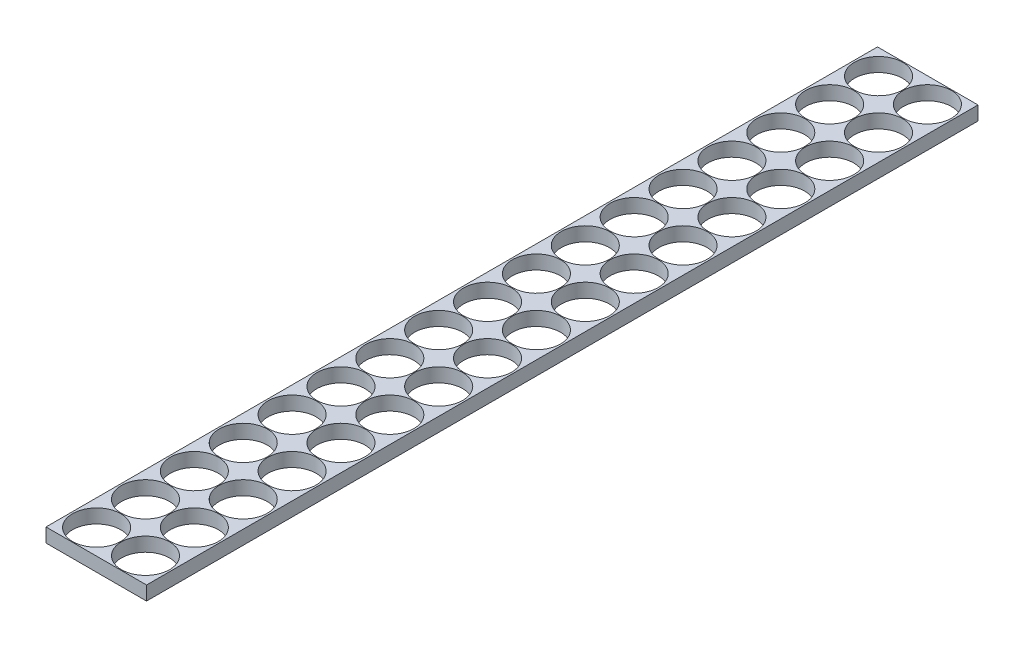
from build123d import *

# Parameters (mm, degrees)
BOSS_EXTRUDE1_DEPTH = 1


with BuildPart() as part:
    # Sketch1 → Boss-Extrude1 (new body)
    with BuildSketch(Plane(origin=(0, 0, 0), x_dir=(1, 0, 0), z_dir=(0, 1, 0))):
        with BuildLine():
            Line((1.85, -59.55), (3.6, -59.55))
            Line((3.6, -59.55), (3.6, 0))
            Line((3.6, 0), (1.85, 0))
            Line((1.85, 0), (1.85, -0.05))
            ThreePointArc((1.85, -0.05), (3.069759198, -0.555240802), (3.575, -1.775))
            ThreePointArc((3.575, -1.775), (3.069759198, -2.994759198), (1.85, -3.5))
            Line((1.85, -3.5), (1.85, -3.55))
            ThreePointArc((1.85, -3.55), (3.069759198, -4.055240802), (3.575, -5.275))
            ThreePointArc((3.575, -5.275), (3.069759198, -6.494759198), (1.85, -7))
            Line((1.85, -7), (1.85, -7.05))
            ThreePointArc((1.85, -7.05), (3.069759198, -7.555240802), (3.575, -8.775))
            ThreePointArc((3.575, -8.775), (3.069759198, -9.994759198), (1.85, -10.5))
            Line((1.85, -10.5), (1.85, -10.55))
            ThreePointArc((1.85, -10.55), (3.069759198, -11.055240802), (3.575, -12.275))
            ThreePointArc((3.575, -12.275), (3.069759198, -13.494759198), (1.85, -14))
            Line((1.85, -14), (1.85, -14.05))
            ThreePointArc((1.85, -14.05), (3.069759198, -14.555240802), (3.575, -15.775))
            ThreePointArc((3.575, -15.775), (3.069759198, -16.994759198), (1.85, -17.5))
            Line((1.85, -17.5), (1.85, -17.55))
            ThreePointArc((1.85, -17.55), (3.069759198, -18.055240802), (3.575, -19.275))
            ThreePointArc((3.575, -19.275), (3.069759198, -20.494759198), (1.85, -21))
            Line((1.85, -21), (1.85, -21.05))
            ThreePointArc((1.85, -21.05), (3.069759198, -21.555240802), (3.575, -22.775))
            ThreePointArc((3.575, -22.775), (3.069759198, -23.994759198), (1.85, -24.5))
            Line((1.85, -24.5), (1.85, -24.55))
            ThreePointArc((1.85, -24.55), (3.069759198, -25.055240802), (3.575, -26.275))
            ThreePointArc((3.575, -26.275), (3.069759198, -27.494759198), (1.85, -28))
            Line((1.85, -28), (1.85, -28.05))
            ThreePointArc((1.85, -28.05), (3.069759198, -28.555240802), (3.575, -29.775))
            ThreePointArc((3.575, -29.775), (3.069759198, -30.994759198), (1.85, -31.5))
            Line((1.85, -31.5), (1.85, -31.55))
            ThreePointArc((1.85, -31.55), (3.069759198, -32.055240802), (3.575, -33.275))
            ThreePointArc((3.575, -33.275), (3.069759198, -34.494759198), (1.85, -35))
            Line((1.85, -35), (1.85, -35.05))
            ThreePointArc((1.85, -35.05), (3.069759198, -35.555240802), (3.575, -36.775))
            ThreePointArc((3.575, -36.775), (3.069759198, -37.994759198), (1.85, -38.5))
            Line((1.85, -38.5), (1.85, -38.55))
            ThreePointArc((1.85, -38.55), (3.069759198, -39.055240802), (3.575, -40.275))
            ThreePointArc((3.575, -40.275), (3.069759198, -41.494759198), (1.85, -42))
            Line((1.85, -42), (1.85, -42.05))
            ThreePointArc((1.85, -42.05), (3.069759198, -42.555240802), (3.575, -43.775))
            ThreePointArc((3.575, -43.775), (3.069759198, -44.994759198), (1.85, -45.5))
            Line((1.85, -45.5), (1.85, -45.55))
            ThreePointArc((1.85, -45.55), (3.069759198, -46.055240802), (3.575, -47.275))
            ThreePointArc((3.575, -47.275), (3.069759198, -48.494759198), (1.85, -49))
            Line((1.85, -49), (1.85, -49.05))
            ThreePointArc((1.85, -49.05), (3.069759198, -49.555240802), (3.575, -50.775))
            ThreePointArc((3.575, -50.775), (3.069759198, -51.994759198), (1.85, -52.5))
            Line((1.85, -52.5), (1.85, -52.55))
            ThreePointArc((1.85, -52.55), (3.069759198, -53.055240802), (3.575, -54.275))
            ThreePointArc((3.575, -54.275), (3.069759198, -55.494759198), (1.85, -56))
            Line((1.85, -56), (1.85, -56.05))
            ThreePointArc((1.85, -56.05), (3.069759198, -56.555240802), (3.575, -57.775))
            ThreePointArc((3.575, -57.775), (3.069759198, -58.994759198), (1.85, -59.5))
            Line((1.85, -59.5), (1.85, -59.55))
        make_face()
        with BuildLine():
            Line((0, -59.55), (1.85, -59.55))
            Line((1.85, -59.55), (1.85, -59.5))
            ThreePointArc((1.85, -59.5), (0.125, -57.775), (1.85, -56.05))
            Line((1.85, -56.05), (1.85, -56))
            ThreePointArc((1.85, -56), (0.125, -54.275), (1.85, -52.55))
            Line((1.85, -52.55), (1.85, -52.5))
            ThreePointArc((1.85, -52.5), (0.125, -50.775), (1.85, -49.05))
            Line((1.85, -49.05), (1.85, -49))
            ThreePointArc((1.85, -49), (0.125, -47.275), (1.85, -45.55))
            Line((1.85, -45.55), (1.85, -45.5))
            ThreePointArc((1.85, -45.5), (0.125, -43.775), (1.85, -42.05))
            Line((1.85, -42.05), (1.85, -42))
            ThreePointArc((1.85, -42), (0.125, -40.275), (1.85, -38.55))
            Line((1.85, -38.55), (1.85, -38.5))
            ThreePointArc((1.85, -38.5), (0.125, -36.775), (1.85, -35.05))
            Line((1.85, -35.05), (1.85, -35))
            ThreePointArc((1.85, -35), (0.125, -33.275), (1.85, -31.55))
            Line((1.85, -31.55), (1.85, -31.5))
            ThreePointArc((1.85, -31.5), (0.125, -29.775), (1.85, -28.05))
            Line((1.85, -28.05), (1.85, -28))
            ThreePointArc((1.85, -28), (0.125, -26.275), (1.85, -24.55))
            Line((1.85, -24.55), (1.85, -24.5))
            ThreePointArc((1.85, -24.5), (0.125, -22.775), (1.85, -21.05))
            Line((1.85, -21.05), (1.85, -21))
            ThreePointArc((1.85, -21), (0.125, -19.275), (1.85, -17.55))
            Line((1.85, -17.55), (1.85, -17.5))
            ThreePointArc((1.85, -17.5), (0.125, -15.775), (1.85, -14.05))
            Line((1.85, -14.05), (1.85, -14))
            ThreePointArc((1.85, -14), (0.125, -12.275), (1.85, -10.55))
            Line((1.85, -10.55), (1.85, -10.5))
            ThreePointArc((1.85, -10.5), (0.125, -8.775), (1.85, -7.05))
            Line((1.85, -7.05), (1.85, -7))
            ThreePointArc((1.85, -7), (0.125, -5.275), (1.85, -3.55))
            Line((1.85, -3.55), (1.85, -3.5))
            ThreePointArc((1.85, -3.5), (0.125, -1.775), (1.85, -0.05))
            Line((1.85, -0.05), (1.85, 0))
            Line((1.85, 0), (0, 0))
            Line((0, 0), (0, -59.55))
        make_face()
        with BuildLine():
            Line((5.35, -59.5), (5.35, -59.55))
            Line((5.35, -59.55), (7.2, -59.55))
            Line((7.2, -59.55), (7.2, 0))
            Line((7.2, 0), (5.35, 0))
            Line((5.35, 0), (5.35, -0.05))
            ThreePointArc((5.35, -0.05), (6.569759198, -0.555240802), (7.075, -1.775))
            ThreePointArc((7.075, -1.775), (6.569759198, -2.994759198), (5.35, -3.5))
            Line((5.35, -3.5), (5.35, -3.55))
            ThreePointArc((5.35, -3.55), (6.569759198, -4.055240802), (7.075, -5.275))
            ThreePointArc((7.075, -5.275), (6.569759198, -6.494759198), (5.35, -7))
            Line((5.35, -7), (5.35, -7.05))
            ThreePointArc((5.35, -7.05), (6.569759198, -7.555240802), (7.075, -8.775))
            ThreePointArc((7.075, -8.775), (6.569759198, -9.994759198), (5.35, -10.5))
            Line((5.35, -10.5), (5.35, -10.55))
            ThreePointArc((5.35, -10.55), (6.569759198, -11.055240802), (7.075, -12.275))
            ThreePointArc((7.075, -12.275), (6.569759198, -13.494759198), (5.35, -14))
            Line((5.35, -14), (5.35, -14.05))
            ThreePointArc((5.35, -14.05), (6.569759198, -14.555240802), (7.075, -15.775))
            ThreePointArc((7.075, -15.775), (6.569759198, -16.994759198), (5.35, -17.5))
            Line((5.35, -17.5), (5.35, -17.55))
            ThreePointArc((5.35, -17.55), (6.569759198, -18.055240802), (7.075, -19.275))
            ThreePointArc((7.075, -19.275), (6.569759198, -20.494759198), (5.35, -21))
            Line((5.35, -21), (5.35, -21.05))
            ThreePointArc((5.35, -21.05), (6.569759198, -21.555240802), (7.075, -22.775))
            ThreePointArc((7.075, -22.775), (6.569759198, -23.994759198), (5.35, -24.5))
            Line((5.35, -24.5), (5.35, -24.55))
            ThreePointArc((5.35, -24.55), (6.569759198, -25.055240802), (7.075, -26.275))
            ThreePointArc((7.075, -26.275), (6.569759198, -27.494759198), (5.35, -28))
            Line((5.35, -28), (5.35, -28.05))
            ThreePointArc((5.35, -28.05), (6.569759198, -28.555240802), (7.075, -29.775))
            ThreePointArc((7.075, -29.775), (6.569759198, -30.994759198), (5.35, -31.5))
            Line((5.35, -31.5), (5.35, -31.55))
            ThreePointArc((5.35, -31.55), (6.569759198, -32.055240802), (7.075, -33.275))
            ThreePointArc((7.075, -33.275), (6.569759198, -34.494759198), (5.35, -35))
            Line((5.35, -35), (5.35, -35.05))
            ThreePointArc((5.35, -35.05), (6.569759198, -35.555240802), (7.075, -36.775))
            ThreePointArc((7.075, -36.775), (6.569759198, -37.994759198), (5.35, -38.5))
            Line((5.35, -38.5), (5.35, -38.55))
            ThreePointArc((5.35, -38.55), (6.569759198, -39.055240802), (7.075, -40.275))
            ThreePointArc((7.075, -40.275), (6.569759198, -41.494759198), (5.35, -42))
            Line((5.35, -42), (5.35, -42.05))
            ThreePointArc((5.35, -42.05), (6.569759198, -42.555240802), (7.075, -43.775))
            ThreePointArc((7.075, -43.775), (6.569759198, -44.994759198), (5.35, -45.5))
            Line((5.35, -45.5), (5.35, -45.55))
            ThreePointArc((5.35, -45.55), (6.569759198, -46.055240802), (7.075, -47.275))
            ThreePointArc((7.075, -47.275), (6.569759198, -48.494759198), (5.35, -49))
            Line((5.35, -49), (5.35, -49.05))
            ThreePointArc((5.35, -49.05), (6.569759198, -49.555240802), (7.075, -50.775))
            ThreePointArc((7.075, -50.775), (6.569759198, -51.994759198), (5.35, -52.5))
            Line((5.35, -52.5), (5.35, -52.55))
            ThreePointArc((5.35, -52.55), (6.569759198, -53.055240802), (7.075, -54.275))
            ThreePointArc((7.075, -54.275), (6.569759198, -55.494759198), (5.35, -56))
            Line((5.35, -56), (5.35, -56.05))
            ThreePointArc((5.35, -56.05), (6.569759198, -56.555240802), (7.075, -57.775))
            ThreePointArc((7.075, -57.775), (6.569759198, -58.994759198), (5.35, -59.5))
        make_face()
        with BuildLine():
            Line((3.6, 0), (3.6, -59.55))
            Line((3.6, -59.55), (5.35, -59.55))
            Line((5.35, -59.55), (5.35, -59.5))
            ThreePointArc((5.35, -59.5), (3.625, -57.775), (5.35, -56.05))
            Line((5.35, -56.05), (5.35, -56))
            ThreePointArc((5.35, -56), (3.625, -54.275), (5.35, -52.55))
            Line((5.35, -52.55), (5.35, -52.5))
            ThreePointArc((5.35, -52.5), (3.625, -50.775), (5.35, -49.05))
            Line((5.35, -49.05), (5.35, -49))
            ThreePointArc((5.35, -49), (3.625, -47.275), (5.35, -45.55))
            Line((5.35, -45.55), (5.35, -45.5))
            ThreePointArc((5.35, -45.5), (3.625, -43.775), (5.35, -42.05))
            Line((5.35, -42.05), (5.35, -42))
            ThreePointArc((5.35, -42), (3.625, -40.275), (5.35, -38.55))
            Line((5.35, -38.55), (5.35, -38.5))
            ThreePointArc((5.35, -38.5), (3.625, -36.775), (5.35, -35.05))
            Line((5.35, -35.05), (5.35, -35))
            ThreePointArc((5.35, -35), (3.625, -33.275), (5.35, -31.55))
            Line((5.35, -31.55), (5.35, -31.5))
            ThreePointArc((5.35, -31.5), (3.625, -29.775), (5.35, -28.05))
            Line((5.35, -28.05), (5.35, -28))
            ThreePointArc((5.35, -28), (3.625, -26.275), (5.35, -24.55))
            Line((5.35, -24.55), (5.35, -24.5))
            ThreePointArc((5.35, -24.5), (3.625, -22.775), (5.35, -21.05))
            Line((5.35, -21.05), (5.35, -21))
            ThreePointArc((5.35, -21), (3.625, -19.275), (5.35, -17.55))
            Line((5.35, -17.55), (5.35, -17.5))
            ThreePointArc((5.35, -17.5), (3.625, -15.775), (5.35, -14.05))
            Line((5.35, -14.05), (5.35, -14))
            ThreePointArc((5.35, -14), (3.625, -12.275), (5.35, -10.55))
            Line((5.35, -10.55), (5.35, -10.5))
            ThreePointArc((5.35, -10.5), (3.625, -8.775), (5.35, -7.05))
            Line((5.35, -7.05), (5.35, -7))
            ThreePointArc((5.35, -7), (3.625, -5.275), (5.35, -3.55))
            Line((5.35, -3.55), (5.35, -3.5))
            ThreePointArc((5.35, -3.5), (3.625, -1.775), (5.35, -0.05))
            Line((5.35, -0.05), (5.35, 0))
            Line((5.35, 0), (3.6, 0))
        make_face()
    extrude(amount=BOSS_EXTRUDE1_DEPTH)


solid = part.part
